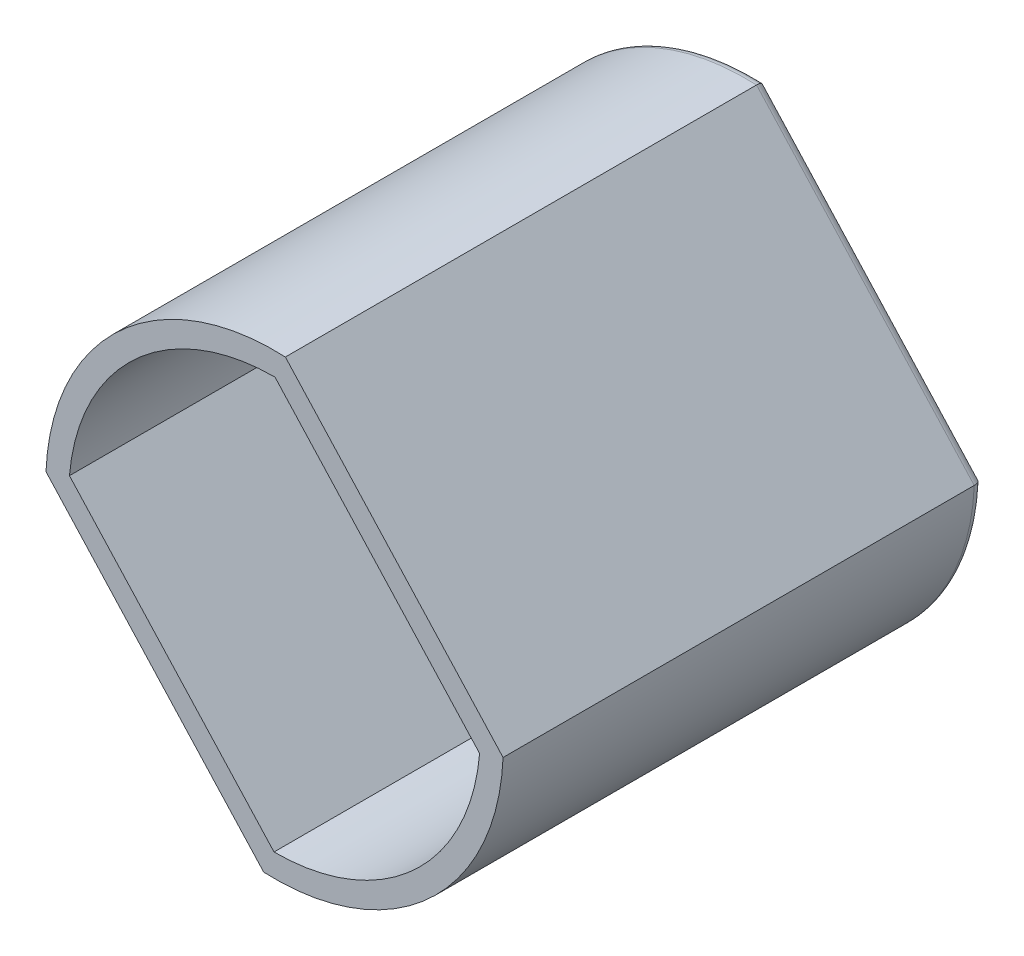
from build123d import *

# Parameters (mm, degrees)
BOSS_EXTRUDE1_DEPTH = 20
BOSS_EXTRUDE2_START = 1
BOSS_EXTRUDE2_DEPTH = 1
FILLET1_R           = 0.4
SKETCH3_R           = 2
BOSS_EXTRUDE3_DEPTH = 1
SKETCH4_R           = 0.75
CUT_EXTRUDE1_DEPTH  = 27.150121814


with BuildPart() as part:
    # Sketch1 → Boss-Extrude1 (new body)
    with BuildSketch(Plane.XY):
        with BuildLine():
            Line((-9.991439682, 0.413682349), (-0.473124093, -9.988801409))
            ThreePointArc((-0.473124093, -9.988801409), (6.750578432, -7.377648056), (9.991439682, -0.413682349))
            Line((9.991439682, -0.413682349), (0.473124093, 9.988801409))
            ThreePointArc((0.473124093, 9.988801409), (-6.750578432, 7.377648056), (-9.991439682, 0.413682349))
        make_face()
        with BuildLine():
            Line((-8.966572571, 0.774968597), (-0.022461592, -8.999971971))
            ThreePointArc((-0.022461592, -8.999971971), (6.075520589, -6.63988325), (8.966572571, -0.774968597))
            Line((8.966572571, -0.774968597), (0.022461592, 8.999971971))
            ThreePointArc((0.022461592, 8.999971971), (-6.075520589, 6.63988325), (-8.966572571, 0.774968597))
        make_face(mode=Mode.SUBTRACT)
    extrude(amount=BOSS_EXTRUDE1_DEPTH)

    # Sketch2 → Boss-Extrude2 (add)
    with BuildSketch(Plane(origin=(0, 0, 0), x_dir=(-1, 0, 0), z_dir=(0, 0, -1)).offset(BOSS_EXTRUDE2_START)):
        with BuildLine():
            Line((-0.473124093, 9.988801409), (-9.991439682, -0.413682349))
            ThreePointArc((-9.991439682, -0.413682349), (-6.750578432, -7.377648056), (0.473124093, -9.988801409))
            Line((0.473124093, -9.988801409), (9.991439682, 0.413682349))
            ThreePointArc((9.991439682, 0.413682349), (6.750578432, 7.377648056), (-0.473124093, 9.988801409))
        make_face()
    extrude(amount=-BOSS_EXTRUDE2_DEPTH)

    # Fillet1
    fillet1_edges = [part.edges().sort_by_distance(p)[0] for p in [
        (-6.750578432, 7.377648056, -1),
        (5.232281887, 4.78755953, -1),
        (6.750578432, -7.377648056, -1),
        (-5.232281887, -4.78755953, -1),
    ]]
    fillet(fillet1_edges, radius=FILLET1_R)

    # Sketch3 → Boss-Extrude3 (add)
    with BuildSketch(Plane(origin=(0, 0, -1), x_dir=(-1, 0, 0), z_dir=(0, 0, -1))):
        Circle(SKETCH3_R)
    extrude(amount=BOSS_EXTRUDE3_DEPTH)

    # Sketch4 → Cut-Extrude1 (cut, through all)
    with BuildSketch(Plane(origin=(0, 0, -2), x_dir=(-1, 0, 0), z_dir=(0, 0, -1))):
        Circle(SKETCH4_R)
    extrude(amount=-CUT_EXTRUDE1_DEPTH, mode=Mode.SUBTRACT)


solid = part.part
